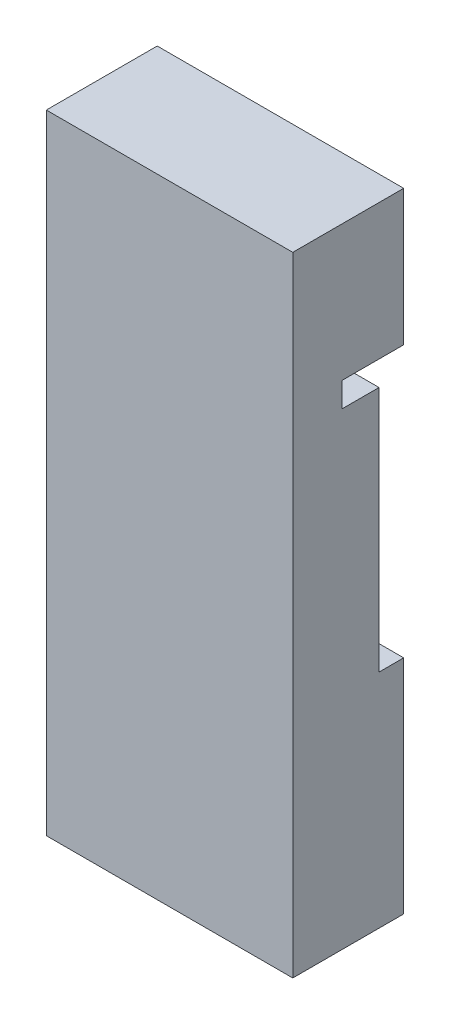
from build123d import *

# Parameters (mm, degrees)
ESQUISSE1_W             = 20
ESQUISSE1_H             = 51
EXTRUSION1_DEPTH        = 9
ESQUISSE3_W             = 7
ESQUISSE3_H             = 20
ENL_V_MAT_EXTRU_1_DEPTH = 2
ENL_V_MAT_EXTRU_2_REACH = 52.881
ESQUISSE4_W             = 5
ESQUISSE4_H             = 2


with BuildPart() as part:
    # Esquisse1 → Extrusion1 (new body)
    with BuildSketch(Plane.XY):
        with Locations((-5.903123543, -20.411538462)):
            Rectangle(ESQUISSE1_W, ESQUISSE1_H)
    extrude(amount=EXTRUSION1_DEPTH)

    # Esquisse3 → Enlèv. mat.-Extru.1 (cut)
    with BuildSketch(Plane(origin=(0, 0, 0), x_dir=(-1, 0, 0), z_dir=(0, 0, -1))):
        with Locations((-0.596876457, -17.911538462)):
            Rectangle(ESQUISSE3_W, ESQUISSE3_H)
    extrude(amount=-ENL_V_MAT_EXTRU_1_DEPTH, mode=Mode.SUBTRACT)

    # Esquisse4 → Enlèv. mat.-Extru.2 (cut, up to next)
    with BuildSketch(Plane(origin=(4.096876457, 0, 0), x_dir=(0, 0, -1), z_dir=(1, 0, 0)), mode=Mode.PRIVATE) as enl_v_mat_extru_2_sk1:
        with Locations((-2.5, -6.911538462)):
            Rectangle(ESQUISSE4_W, ESQUISSE4_H)
    enl_v_mat_extru_2_tool1 = extrude(enl_v_mat_extru_2_sk1.sketch, amount=-ENL_V_MAT_EXTRU_2_REACH, mode=Mode.PRIVATE) & part.part
    add(enl_v_mat_extru_2_tool1.solids().sort_by_distance((4.096876, -6.911538, 2.5))[0], mode=Mode.SUBTRACT)


solid = part.part
